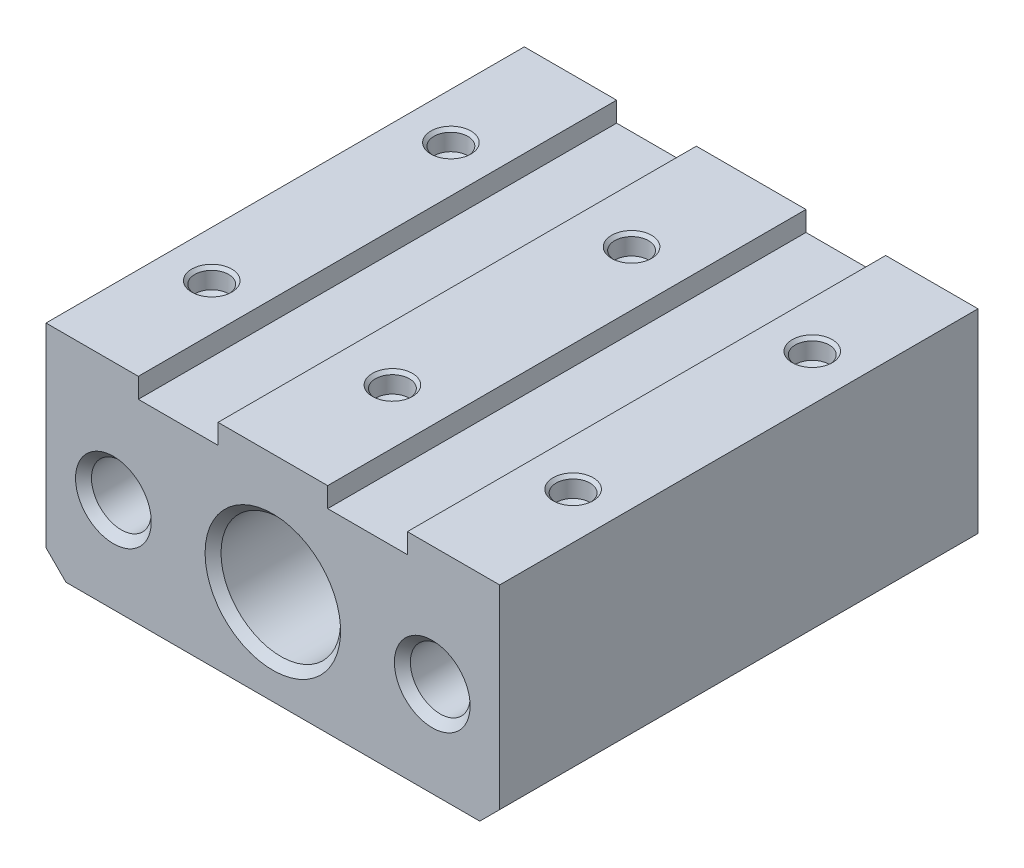
from build123d import *

# Parameters (mm, degrees)
SKETCH_1_W                    = 120.40825663
SKETCH_1_H                    = 69.987299166
EXTRUDE_1_DEPTH               = 30
CUT_EXTRUDE_1_DEPTH           = 98.070897342
CUT_EXTRUDE_1_DEPTH_BACK      = 98.070897342
SKETCH_2_W                    = 9.395515641
SKETCH_2_H                    = 48.745871703
SKETCH_3_W                    = 113.81790299
SKETCH_3_H                    = 30
EXTRUDE_2_DEPTH               = 69.987299167
SKETCH_4_W                    = 113.81790299
SKETCH_4_H                    = 3.825309314
EXTRUDE_3_DEPTH               = 69.987299167
SKETCH_5_W                    = 120
SKETCH_5_H                    = 63.825309314
EXTRUDE_4_DEPTH               = 113.817902989
CUT_EXTRUDE_2_DEPTH           = 148.350937795
CUT_EXTRUDE_2_DEPTH_BACK      = 148.350937795
SKETCH_6_R                    = 15
SKETCH_6_R_2                  = 7.5
CUT_EXTRUDE_3_DEPTH           = 148.350937795
CUT_EXTRUDE_3_DEPTH_BACK      = 148.350937795
SKETCH_7_W                    = 113.81790299
SKETCH_7_H                    = 11.234457722
CUT_EXTRUDE_4_DEPTH           = 148.350937795
CUT_EXTRUDE_4_DEPTH_BACK      = 148.350937795
SKETCH_8_W                    = 20
SKETCH_8_H                    = 5
CHAMFER_1_SIZE                = 5
CHAMFER_2_SIZE                = 2
HOLE_WIZARD_M10_1_D           = 8.5
HOLE_WIZARD_M10_1_DEPTH       = 5
HOLE_WIZARD_M10_1_CSINK_D     = 10.05
HOLE_WIZARD_M10_1_CSINK_ANGLE = 90
HOLE_WIZARD_M10_1_TIP         = 2.553657631


with BuildPart() as part:
    # 草图1 → 凸台-拉伸1 (new body)
    with BuildSketch(Plane(origin=(0, 0, 0), x_dir=(1, 0, 0), z_dir=(0, 1, 0))):
        Rectangle(SKETCH_1_W, SKETCH_1_H)
    extrude(amount=EXTRUDE_1_DEPTH)

    # 草图2 → 切除-拉伸1 (cut, two sides: drawn at the far end of the back side and taken through both)
    with BuildSketch(Plane.XY.offset(34.993649583).offset(-CUT_EXTRUDE_1_DEPTH_BACK)):
        with Locations((-61.606709315, 9.40788871)):
            Rectangle(SKETCH_2_W, SKETCH_2_H)
        Polygon((56.908951495, -11.846624373), (56.908951495, 33.780824562), (63.684524074, 33.780824562), (62.913393862, -11.846624373), align=None)
    extrude(amount=CUT_EXTRUDE_1_DEPTH + CUT_EXTRUDE_1_DEPTH_BACK, mode=Mode.SUBTRACT)

    # 草图3 → 凸台-拉伸2 (add)
    with BuildSketch(Plane.XY.offset(34.993649583)):
        with Locations((0, 45)):
            Rectangle(SKETCH_3_W, SKETCH_3_H)
    extrude(amount=-EXTRUDE_2_DEPTH)

    # 草图4 → 凸台-拉伸3 (add)
    with BuildSketch(Plane.XY.offset(34.993649583)):
        with Locations((0, 61.912654657)):
            Rectangle(SKETCH_4_W, SKETCH_4_H)
    extrude(amount=-EXTRUDE_3_DEPTH)

    # 草图5 → 凸台-拉伸4 (add)
    with BuildSketch(Plane(origin=(56.908951495, 0, 0), x_dir=(0, 0, -1), z_dir=(1, 0, 0))):
        with Locations((25.006350417, 31.912654657)):
            Rectangle(SKETCH_5_W, SKETCH_5_H)
    extrude(amount=-EXTRUDE_4_DEPTH)

    # 草图6 → 切除-拉伸2 (cut, two sides: drawn at the far end of the back side and taken through both)
    with BuildSketch(Plane.XY.offset(34.993649583).offset(-CUT_EXTRUDE_2_DEPTH_BACK)):
        with Locations((0, 33.825309314)):
            Circle(SKETCH_6_R)
        with Locations((-40, 33.825309314)):
            Circle(SKETCH_6_R_2)
        with Locations((40, 33.825309314)):
            Circle(SKETCH_6_R_2)
    extrude(amount=CUT_EXTRUDE_2_DEPTH + CUT_EXTRUDE_2_DEPTH_BACK, mode=Mode.SUBTRACT)

    # 草图7 → 切除-拉伸3 (cut, two sides: drawn at the far end of the back side and taken through both)
    with BuildSketch(Plane.XY.offset(34.993649583).offset(-CUT_EXTRUDE_3_DEPTH_BACK)):
        with Locations((0, 4.382771139)):
            Rectangle(SKETCH_7_W, SKETCH_7_H)
    extrude(amount=CUT_EXTRUDE_3_DEPTH + CUT_EXTRUDE_3_DEPTH_BACK, mode=Mode.SUBTRACT)

    # 草图8 → 切除-拉伸4 (cut, two sides: drawn at the far end of the back side and taken through both)
    with BuildSketch(Plane.XY.offset(34.993649583).offset(-CUT_EXTRUDE_4_DEPTH_BACK)):
        with Locations((-23.75, 61.325309314)):
            Rectangle(SKETCH_8_W, SKETCH_8_H)
        with Locations((23.75, 61.325309314)):
            Rectangle(SKETCH_8_W, SKETCH_8_H)
    extrude(amount=CUT_EXTRUDE_4_DEPTH + CUT_EXTRUDE_4_DEPTH_BACK, mode=Mode.SUBTRACT)

    # 倒角1
    chamfer_1_edges = [part.edges().sort_by_distance(p)[0] for p in [
        (-56.908951495, 10, -25.006350417),
        (56.908951495, 10, -25.006350417),
    ]]
    chamfer(chamfer_1_edges, length=CHAMFER_1_SIZE)

    # 倒角2
    chamfer_2_edges = [part.edges().sort_by_distance(p)[0] for p in [
        (32.5, 33.825309314, -85.006350417),
        (32.5, 33.825309314, 34.993649583),
        (-47.5, 33.825309314, -85.006350417),
        (-47.5, 33.825309314, 34.993649583),
        (-15, 33.825309314, -85.006350417),
        (-15, 33.825309314, 34.993649583),
    ]]
    chamfer(chamfer_2_edges, length=CHAMFER_2_SIZE)

    # M10 螺纹孔1
    with Locations(Plane(origin=(0, 63.825309314, 0), x_dir=(1, 0, 0), z_dir=(0, 1, 0))):
        with Locations((-45.329475747, 55.006350417), (-45.329475747, -4.993649583), (0, -4.993649583), (45.329475747, -4.993649583), (45.329475747, 55.006350417), (0, 55.006350417)):
            CounterSinkHole(HOLE_WIZARD_M10_1_D / 2, HOLE_WIZARD_M10_1_CSINK_D / 2, depth=HOLE_WIZARD_M10_1_DEPTH, counter_sink_angle=HOLE_WIZARD_M10_1_CSINK_ANGLE)
            with Locations((0, 0, -(HOLE_WIZARD_M10_1_DEPTH + HOLE_WIZARD_M10_1_TIP / 2))):  # 118° drill point
                Cone(0, HOLE_WIZARD_M10_1_D / 2, HOLE_WIZARD_M10_1_TIP, mode=Mode.SUBTRACT)


solid = part.part
